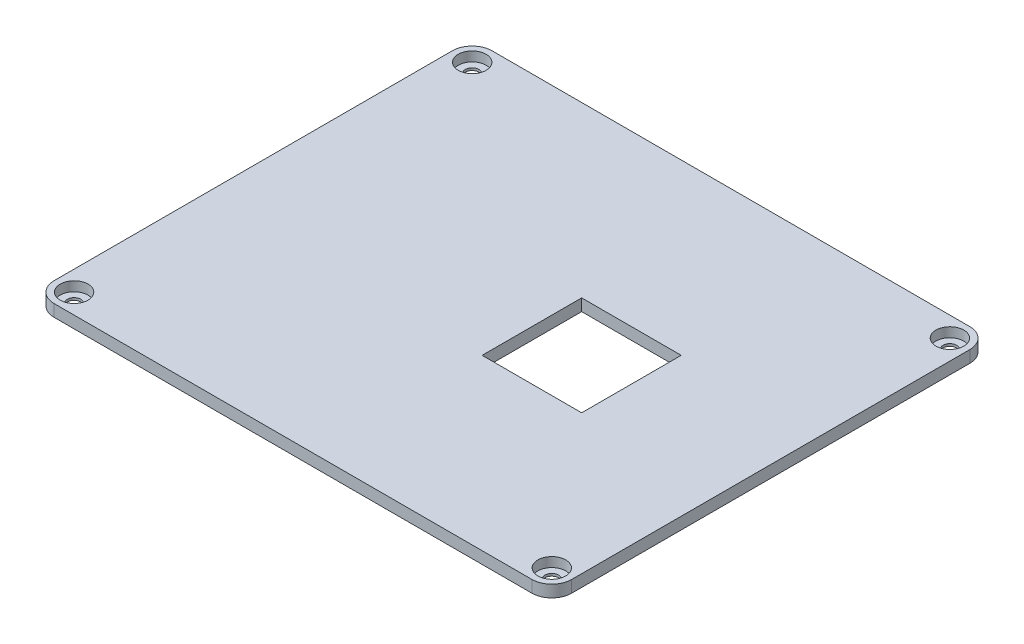
from build123d import *

# Parameters (mm, degrees)
SKETCH1_W                                        = 130
SKETCH1_H                                        = 110
BOSS_EXTRUDE1_DEPTH                              = 3
CBORE_FOR_M3_PAN_HEAD_MACHINE_SCREW1_D           = 3.4
CBORE_FOR_M3_PAN_HEAD_MACHINE_SCREW1_DEPTH       = 7
CBORE_FOR_M3_PAN_HEAD_MACHINE_SCREW1_CBORE_D     = 7
CBORE_FOR_M3_PAN_HEAD_MACHINE_SCREW1_CBORE_DEPTH = 2.4
CBORE_FOR_M3_PAN_HEAD_MACHINE_SCREW1_TIP         = 1.021463052
SKETCH10_W                                       = 25
SKETCH10_H                                       = 25
CUT_EXTRUDE1_DEPTH                               = 5
FILLET1_R                                        = 5


with BuildPart() as part:
    # Sketch1 → Boss-Extrude1 (new body)
    with BuildSketch(Plane(origin=(0, 0, 0), x_dir=(1, 0, 0), z_dir=(0, 1, 0))):
        with Locations((65, 55)):
            Rectangle(SKETCH1_W, SKETCH1_H)
    extrude(amount=BOSS_EXTRUDE1_DEPTH)

    # CBORE for M3 Pan Head Machine Screw1
    with Locations(Plane(origin=(0, 3, 0), x_dir=(1, 0, 0), z_dir=(0, 1, 0))):
        with Locations((5, 105), (125, 105), (125, 5), (5, 5)):
            CounterBoreHole(CBORE_FOR_M3_PAN_HEAD_MACHINE_SCREW1_D / 2, CBORE_FOR_M3_PAN_HEAD_MACHINE_SCREW1_CBORE_D / 2, CBORE_FOR_M3_PAN_HEAD_MACHINE_SCREW1_CBORE_DEPTH, depth=CBORE_FOR_M3_PAN_HEAD_MACHINE_SCREW1_DEPTH)
            with Locations((0, 0, -(CBORE_FOR_M3_PAN_HEAD_MACHINE_SCREW1_DEPTH + CBORE_FOR_M3_PAN_HEAD_MACHINE_SCREW1_TIP / 2))):  # 118° drill point
                Cone(0, CBORE_FOR_M3_PAN_HEAD_MACHINE_SCREW1_D / 2, CBORE_FOR_M3_PAN_HEAD_MACHINE_SCREW1_TIP, mode=Mode.SUBTRACT)

    # Sketch10 → Cut-Extrude1 (cut)
    with BuildSketch(Plane(origin=(0, 3, 0), x_dir=(1, 0, 0), z_dir=(0, 1, 0))):
        with Locations((82.5, 55)):
            Rectangle(SKETCH10_W, SKETCH10_H)
    extrude(amount=-CUT_EXTRUDE1_DEPTH, mode=Mode.SUBTRACT)

    # Fillet1
    fillet1_edges = [part.edges().sort_by_distance(p)[0] for p in [
        (0, 1.5, -110),
        (130, 1.5, -110),
        (130, 1.5, 0),
        (0, 1.5, 0),
    ]]
    fillet(fillet1_edges, radius=FILLET1_R)


solid = part.part
